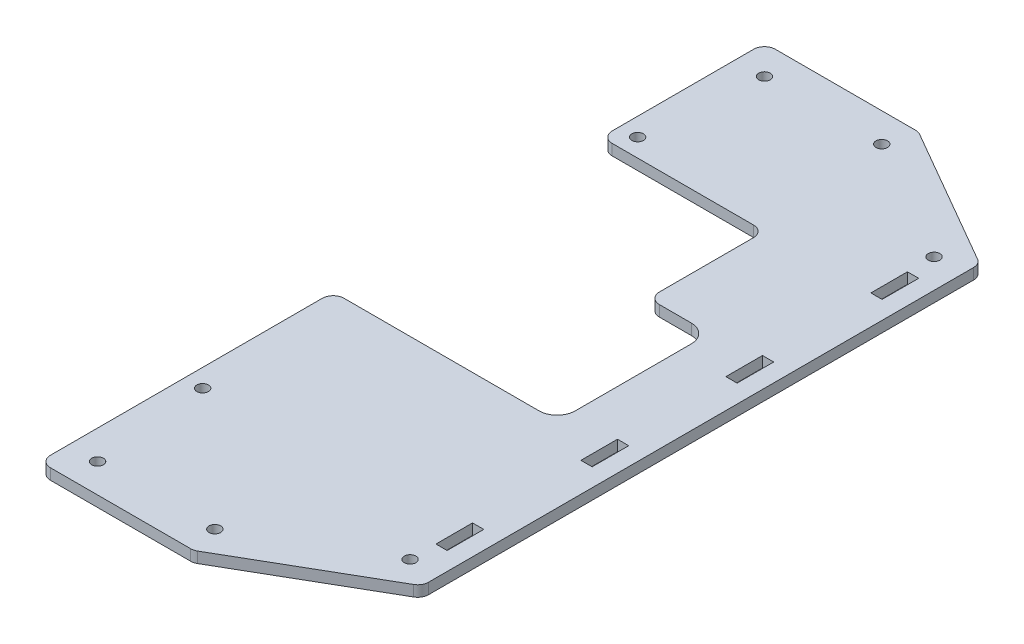
from build123d import *

# Parameters (mm, degrees)
BOSS_EXTRUDE1_DEPTH = 3
CUT_EXTRUDE1_REACH  = 162.106
SKETCH2_W           = 45
SKETCH2_H           = 74
FILLET2_R           = 3
SKETCH3_W           = 3.1
SKETCH3_H           = 10.1
CUT_EXTRUDE2_DEPTH  = 161.106214745
CUT_EXTRUDE3_REACH  = 162.106
SKETCH4_R           = 1.6


with BuildPart() as part:
    # Sketch1 → Boss-Extrude1 (new body)
    with BuildSketch(Plane(origin=(0, 0, 0), x_dir=(1, 0, 0), z_dir=(0, 1, 0))):
        Polygon((42.5, 100), (85, 100), (125, 76.905989232), (125, -76.905989232), (85, -100), (42.5, -100), align=None)
        with BuildLine():
            Line((99.3, 23), (67.3, 23))
            ThreePointArc((67.3, 23), (63.764466094, 21.535533906), (62.3, 18))
            Line((62.3, 18), (62.3, -14))
            ThreePointArc((62.3, -14), (63.764466094, -17.535533906), (67.3, -19))
            Line((67.3, -19), (99.3, -19))
            ThreePointArc((99.3, -19), (102.835533906, -17.535533906), (104.3, -14))
            Line((104.3, -14), (104.3, 18))
            ThreePointArc((104.3, 18), (102.835533906, 21.535533906), (99.3, 23))
        make_face(mode=Mode.SUBTRACT)
    extrude(amount=BOSS_EXTRUDE1_DEPTH)

    # Sketch2 → Cut-Extrude1 (cut, up to next)
    with BuildSketch(Plane(origin=(0, 3, 0), x_dir=(1, 0, 0), z_dir=(0, 1, 0)), mode=Mode.PRIVATE) as cut_extrude1_sk1:
        with Locations((65, 18)):
            Rectangle(SKETCH2_W, SKETCH2_H)
    cut_extrude1_tool1 = extrude(cut_extrude1_sk1.sketch, amount=-CUT_EXTRUDE1_REACH, mode=Mode.PRIVATE) & part.part
    add(cut_extrude1_tool1.solids().sort_by_distance((65, 3, -18))[0], mode=Mode.SUBTRACT)

    # Fillet2
    fillet2_edges = [part.edges().sort_by_distance(p)[0] for p in [
        (125, 1.5, -76.905989232),
        (125, 1.5, 76.905989232),
        (85, 1.5, 100),
        (42.5, 1.5, 100),
        (42.5, 1.5, -100),
        (85, 1.5, -100),
        (42.5, 1.5, 19),
        (42.5, 1.5, -55),
        (87.5, 1.5, -23),
        (87.5, 1.5, -55),
    ]]
    fillet(fillet2_edges, radius=FILLET2_R)

    # Sketch3 → Cut-Extrude2 (cut, through all)
    with BuildSketch(Plane(origin=(0, 3, 0), x_dir=(1, 0, 0), z_dir=(0, 1, 0))):
        with Locations((118.45, 20)):
            Rectangle(SKETCH3_W, SKETCH3_H)
        with Locations((118.45, -20)):
            Rectangle(SKETCH3_W, SKETCH3_H)
        with Locations((118.45, 60)):
            Rectangle(SKETCH3_W, SKETCH3_H)
        with Locations((118.45, -60)):
            Rectangle(SKETCH3_W, SKETCH3_H)
    extrude(amount=-CUT_EXTRUDE2_DEPTH, mode=Mode.SUBTRACT)

    # Sketch4 → Cut-Extrude3 (cut, up to next)
    with BuildSketch(Plane(origin=(0, 3, 0), x_dir=(1, 0, 0), z_dir=(0, 1, 0)), mode=Mode.PRIVATE) as cut_extrude3_sk1:
        with Locations(Location((50.5, 92, 0), (0, 0, 270))):
            Circle(SKETCH4_R)
    cut_extrude3_tool1 = extrude(cut_extrude3_sk1.sketch, amount=-CUT_EXTRUDE3_REACH, mode=Mode.PRIVATE) & part.part
    # Sketch4 → Cut-Extrude3 (cut, up to next)
    with BuildSketch(Plane(origin=(0, 3, 0), x_dir=(1, 0, 0), z_dir=(0, 1, 0)), mode=Mode.PRIVATE) as cut_extrude3_sk2:
        with Locations(Location((47.5, 60, 0), (0, 0, 270))):
            Circle(SKETCH4_R)
    cut_extrude3_tool2 = extrude(cut_extrude3_sk2.sketch, amount=-CUT_EXTRUDE3_REACH, mode=Mode.PRIVATE) & part.part
    # Sketch4 → Cut-Extrude3 (cut, up to next)
    with BuildSketch(Plane(origin=(0, 3, 0), x_dir=(1, 0, 0), z_dir=(0, 1, 0)), mode=Mode.PRIVATE) as cut_extrude3_sk3:
        with Locations(Location((47.5, -60, 0), (0, 0, 270))):
            Circle(SKETCH4_R)
    cut_extrude3_tool3 = extrude(cut_extrude3_sk3.sketch, amount=-CUT_EXTRUDE3_REACH, mode=Mode.PRIVATE) & part.part
    # Sketch4 → Cut-Extrude3 (cut, up to next)
    with BuildSketch(Plane(origin=(0, 3, 0), x_dir=(1, 0, 0), z_dir=(0, 1, 0)), mode=Mode.PRIVATE) as cut_extrude3_sk4:
        with Locations(Location((50.5, -92, 0), (0, 0, 270))):
            Circle(SKETCH4_R)
    cut_extrude3_tool4 = extrude(cut_extrude3_sk4.sketch, amount=-CUT_EXTRUDE3_REACH, mode=Mode.PRIVATE) & part.part
    # Sketch4 → Cut-Extrude3 (cut, up to next)
    with BuildSketch(Plane(origin=(0, 3, 0), x_dir=(1, 0, 0), z_dir=(0, 1, 0)), mode=Mode.PRIVATE) as cut_extrude3_sk5:
        with Locations(Location((117, 72.287187079, 0), (0, 0, 270))):
            Circle(SKETCH4_R)
    cut_extrude3_tool5 = extrude(cut_extrude3_sk5.sketch, amount=-CUT_EXTRUDE3_REACH, mode=Mode.PRIVATE) & part.part
    # Sketch4 → Cut-Extrude3 (cut, up to next)
    with BuildSketch(Plane(origin=(0, 3, 0), x_dir=(1, 0, 0), z_dir=(0, 1, 0)), mode=Mode.PRIVATE) as cut_extrude3_sk6:
        with Locations(Location((117, -72.287187079, 0), (0, 0, 270))):
            Circle(SKETCH4_R)
    cut_extrude3_tool6 = extrude(cut_extrude3_sk6.sketch, amount=-CUT_EXTRUDE3_REACH, mode=Mode.PRIVATE) & part.part
    # Sketch4 → Cut-Extrude3 (cut, up to next)
    with BuildSketch(Plane(origin=(0, 3, 0), x_dir=(1, 0, 0), z_dir=(0, 1, 0)), mode=Mode.PRIVATE) as cut_extrude3_sk7:
        with Locations(Location((82.856406461, 92, 0), (0, 0, 270))):
            Circle(SKETCH4_R)
    cut_extrude3_tool7 = extrude(cut_extrude3_sk7.sketch, amount=-CUT_EXTRUDE3_REACH, mode=Mode.PRIVATE) & part.part
    # Sketch4 → Cut-Extrude3 (cut, up to next)
    with BuildSketch(Plane(origin=(0, 3, 0), x_dir=(1, 0, 0), z_dir=(0, 1, 0)), mode=Mode.PRIVATE) as cut_extrude3_sk8:
        with Locations(Location((82.856406461, -92, 0), (0, 0, 270))):
            Circle(SKETCH4_R)
    cut_extrude3_tool8 = extrude(cut_extrude3_sk8.sketch, amount=-CUT_EXTRUDE3_REACH, mode=Mode.PRIVATE) & part.part
    add(cut_extrude3_tool1.solids().sort_by_distance((50.5, 3, -92))[0], mode=Mode.SUBTRACT)
    add(cut_extrude3_tool2.solids().sort_by_distance((47.5, 3, -60))[0], mode=Mode.SUBTRACT)
    add(cut_extrude3_tool3.solids().sort_by_distance((47.5, 3, 60))[0], mode=Mode.SUBTRACT)
    add(cut_extrude3_tool4.solids().sort_by_distance((50.5, 3, 92))[0], mode=Mode.SUBTRACT)
    add(cut_extrude3_tool5.solids().sort_by_distance((117, 3, -72.287187))[0], mode=Mode.SUBTRACT)
    add(cut_extrude3_tool6.solids().sort_by_distance((117, 3, 72.287187))[0], mode=Mode.SUBTRACT)
    add(cut_extrude3_tool7.solids().sort_by_distance((82.856406, 3, -92))[0], mode=Mode.SUBTRACT)
    add(cut_extrude3_tool8.solids().sort_by_distance((82.856406, 3, 92))[0], mode=Mode.SUBTRACT)


solid = part.part
